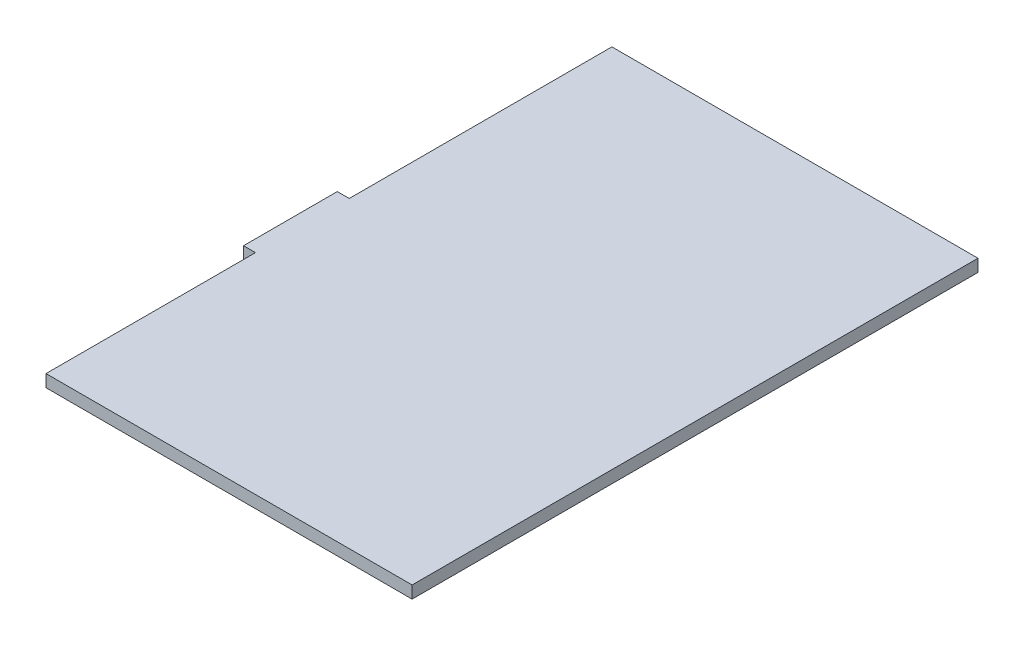
from build123d import *

# Parameters (mm, degrees)
BOSS_EXTRUDE1_DEPTH = 459.74
SKETCH3_W           = 117.668752198
SKETCH3_H           = 459.74
CUT_EXTRUDE1_DEPTH  = 10
SKETCH4_W           = 9.725175386
SKETCH4_H           = 170.179985068
SKETCH4_H_2         = 213.362507046
CUT_EXTRUDE3_DEPTH  = 63


with BuildPart() as part:
    # Sketch1 → Boss-Extrude1 (new body)
    with BuildSketch(Plane.XY):
        Polygon((358.121789204, 754.380000017), (137.961261276, 754.380000017), (137.961261276, 744.380000017), (562.803601281, 744.380000017), (562.803601281, 754.380000017), align=None)
    extrude(amount=BOSS_EXTRUDE1_DEPTH)

    # Sketch3 → Cut-Extrude1 (cut)
    with BuildSketch(Plane.XZ.offset(-744.380000017)):
        with Locations((196.795637375, 229.87)):
            Rectangle(SKETCH3_W, SKETCH3_H)
    extrude(amount=-CUT_EXTRUDE1_DEPTH, mode=Mode.SUBTRACT)

    # Sketch4 → Cut-Extrude3 (cut)
    with BuildSketch(Plane(origin=(0, 754.380000017, 0), x_dir=(1, 0, 0), z_dir=(0, 1, 0))):
        with Locations((260.492601167, -374.650007466)):
            Rectangle(SKETCH4_W, SKETCH4_H)
        with Locations((260.492601167, -106.681253523)):
            Rectangle(SKETCH4_W, SKETCH4_H_2)
    extrude(amount=-CUT_EXTRUDE3_DEPTH, mode=Mode.SUBTRACT)


solid = part.part
